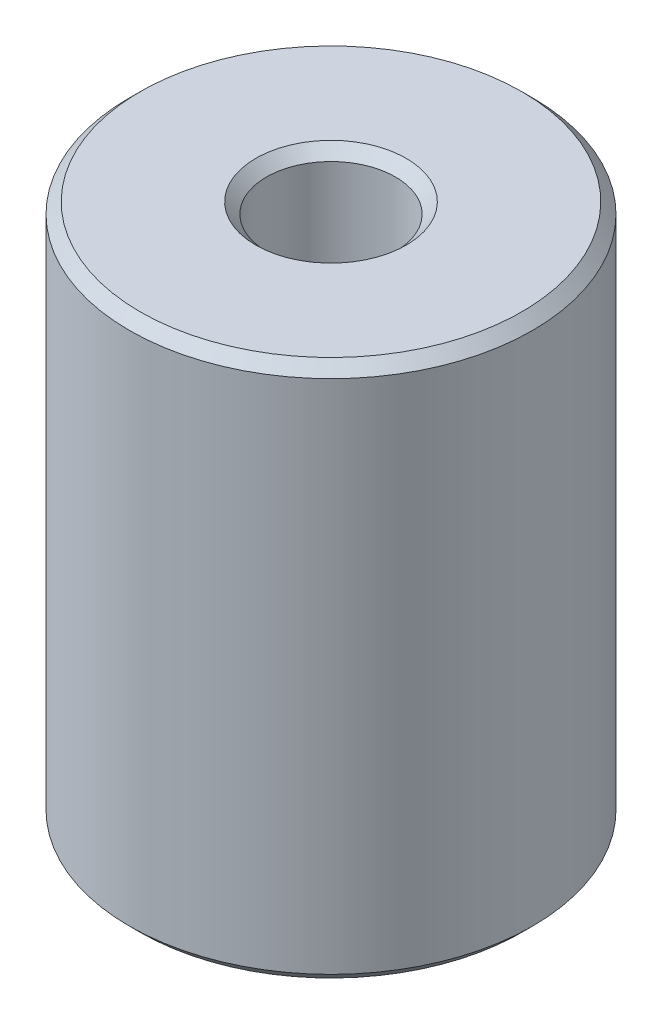
from build123d import *

# Parameters (mm, degrees)
SKETCH1_R           = 4.7625
SKETCH1_R_2         = 1.524
BOSS_EXTRUDE1_DEPTH = 12.7
CHAMFER1_SIZE       = 0.254


with BuildPart() as part:
    # Sketch1 → Boss-Extrude1 (new body)
    with BuildSketch(Plane(origin=(0, 0, 0), x_dir=(1, 0, 0), z_dir=(0, 1, 0))):
        with Locations(Location((0, 0, 0), (0, 0, 270))):
            Circle(SKETCH1_R)
        with Locations(Location((0, 0, 0), (0, 0, 270))):
            Circle(SKETCH1_R_2, mode=Mode.SUBTRACT)
    extrude(amount=BOSS_EXTRUDE1_DEPTH)

    # Chamfer1
    chamfer1_edges = [part.edges().sort_by_distance(p)[0] for p in [
        (0, 0, -4.7625),
        (0, 12.7, -4.7625),
        (0, 0, -1.524),
        (0, 12.7, -1.524),
    ]]
    chamfer(chamfer1_edges, length=CHAMFER1_SIZE)


solid = part.part
